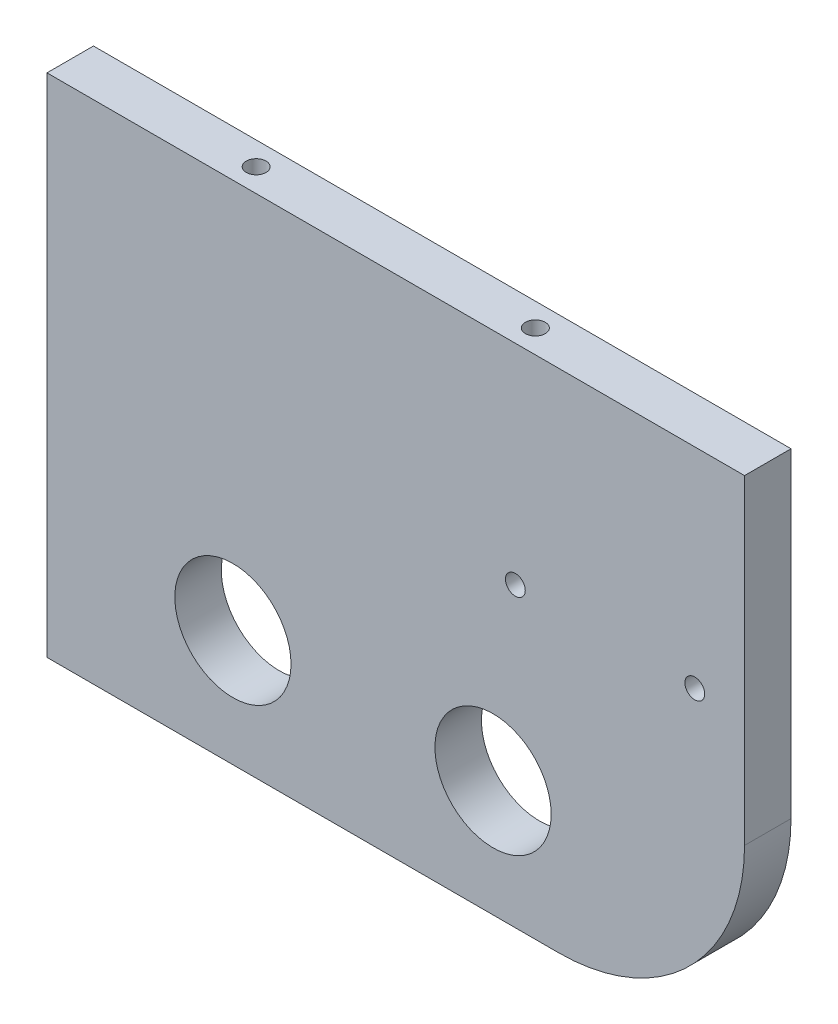
from build123d import *

# Parameters (mm, degrees)
SKETCH1_W                 = 95.287460045
SKETCH1_H                 = 69.153467802
SKETCH1_R                 = 7.9375
BOSS_EXTRUDE1_DEPTH       = 6.35
FILLET1_R                 = 25.4
F_6_32_TAPPED_HOLE1_D     = 2.7051
F_6_32_TAPPED_HOLE1_DEPTH = 10.9728
F_6_32_TAPPED_HOLE1_TIP   = 0.81269403
F_6_32_TAPPED_HOLE2_D     = 2.7051
F_6_32_TAPPED_HOLE2_DEPTH = 9.398
F_6_32_TAPPED_HOLE2_TIP   = 0.81269403
F_6_32_TAPPED_HOLE3_D     = 2.7051
F_6_32_TAPPED_HOLE3_DEPTH = 9.398
F_6_32_TAPPED_HOLE3_TIP   = 0.81269403


with BuildPart() as part:
    # Sketch1 → Boss-Extrude1 (new body)
    with BuildSketch(Plane.XY.offset(-95.039403682)):
        with Locations((-13.289407805, 18.701733901)):
            Rectangle(SKETCH1_W, SKETCH1_H)
        Circle(SKETCH1_R, mode=Mode.SUBTRACT)
        with Locations((-35.533137827, 0)):
            Circle(SKETCH1_R, mode=Mode.SUBTRACT)
    extrude(amount=-BOSS_EXTRUDE1_DEPTH)

    # Fillet1
    fillet1_edges = [part.edges().sort_by_distance(p)[0] for p in [
        (34.354322218, -15.875, -98.214403682),
    ]]
    fillet(fillet1_edges, radius=FILLET1_R)

    # #6-32 Tapped Hole1
    with Locations(Plane.XY.offset(-95.039403682)):
        with Locations((27.559822218, 24.703467802), (3.048822218, 24.703467802)):
            Hole(F_6_32_TAPPED_HOLE1_D / 2, depth=F_6_32_TAPPED_HOLE1_DEPTH)
            with Locations((0, 0, -(F_6_32_TAPPED_HOLE1_DEPTH + F_6_32_TAPPED_HOLE1_TIP / 2))):  # 118° drill point
                Cone(0, F_6_32_TAPPED_HOLE1_D / 2, F_6_32_TAPPED_HOLE1_TIP, mode=Mode.SUBTRACT)

    # #6-32 Tapped Hole2
    with Locations(Plane(origin=(0, 53.278467802, 0), x_dir=(1, 0, 0), z_dir=(0, 1, 0))):
        with Locations((-35.533137827, 98.214403682), (2.604322218, 98.214403682)):
            Hole(F_6_32_TAPPED_HOLE2_D / 2, depth=F_6_32_TAPPED_HOLE2_DEPTH)
            with Locations((0, 0, -(F_6_32_TAPPED_HOLE2_DEPTH + F_6_32_TAPPED_HOLE2_TIP / 2))):  # 118° drill point
                Cone(0, F_6_32_TAPPED_HOLE2_D / 2, F_6_32_TAPPED_HOLE2_TIP, mode=Mode.SUBTRACT)

    # #6-32 Tapped Hole3
    with Locations(Plane.ZY.offset(60.933137827)):
        with Locations((-98.214403682, 45.340967802), (-98.214403682, 6.35)):
            Hole(F_6_32_TAPPED_HOLE3_D / 2, depth=F_6_32_TAPPED_HOLE3_DEPTH)
            with Locations((0, 0, -(F_6_32_TAPPED_HOLE3_DEPTH + F_6_32_TAPPED_HOLE3_TIP / 2))):  # 118° drill point
                Cone(0, F_6_32_TAPPED_HOLE3_D / 2, F_6_32_TAPPED_HOLE3_TIP, mode=Mode.SUBTRACT)


solid = part.part
